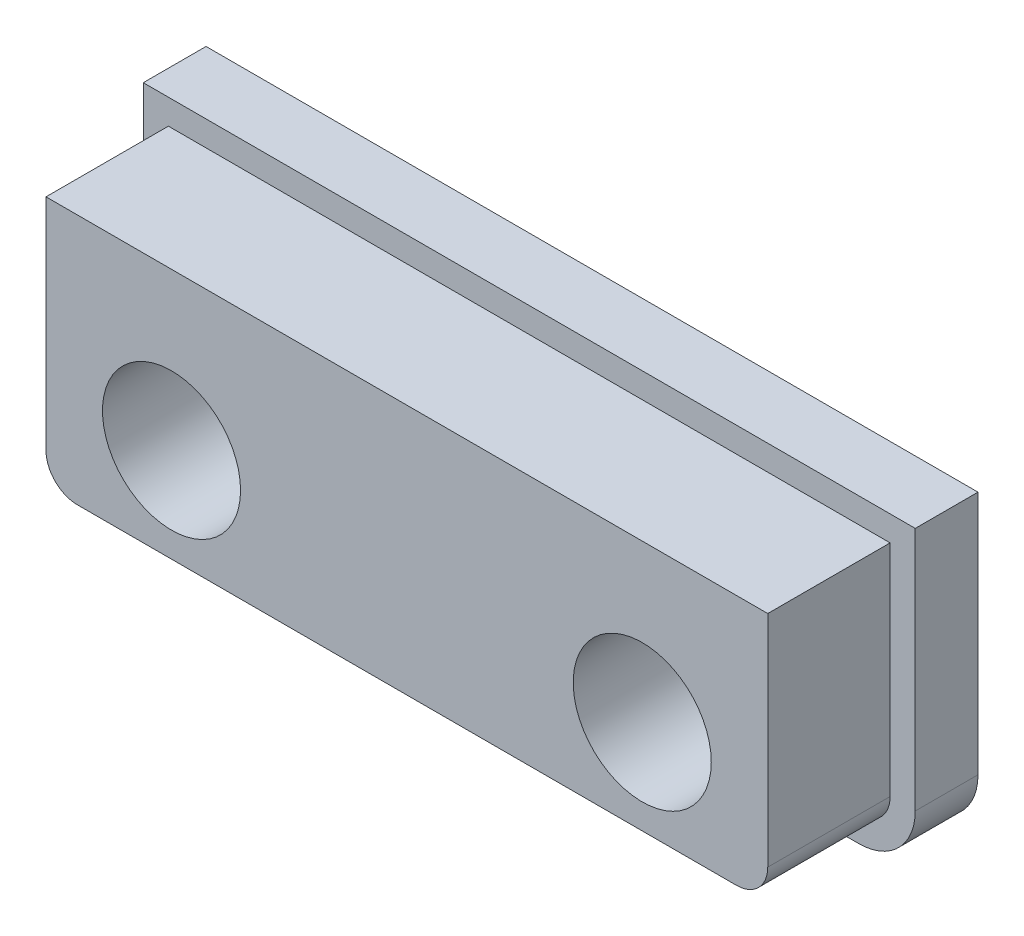
from build123d import *

# Parameters (mm, degrees)
SKETCH1_R           = 2.2
BOSS_EXTRUDE1_DEPTH = 3.9
BOSS_EXTRUDE2_START = -2
SKETCH1_4_R         = 2.2
BOSS_EXTRUDE2_DEPTH = 2


with BuildPart() as part:
    # Sketch1 → Boss-Extrude1 (new body)
    with BuildSketch(Plane.XY):
        with BuildLine():
            ThreePointArc((0, 1), (0.292893219, 0.292893219), (1, 0))
            Line((1, 0), (22, 0))
            ThreePointArc((22, 0), (22.707106781, 0.292893219), (23, 1))
            Line((23, 1), (23, 8))
            Line((23, 8), (0, 8))
            Line((0, 8), (0, 1))
        make_face()
        with Locations((4, 3)):
            Circle(SKETCH1_R, mode=Mode.SUBTRACT)
        with Locations((19, 3)):
            Circle(SKETCH1_R, mode=Mode.SUBTRACT)
    extrude(amount=BOSS_EXTRUDE1_DEPTH)

    # Sketch1<4> → Boss-Extrude2 (add)
    with BuildSketch(Plane.XY.offset(BOSS_EXTRUDE2_START)):
        with BuildLine():
            Line((-0.8, 8.8), (-0.8, 1))
            ThreePointArc((-0.8, 1), (-0.272792206, -0.272792206), (1, -0.8))
            Line((1, -0.8), (22, -0.8))
            ThreePointArc((22, -0.8), (23.272792206, -0.272792206), (23.8, 1))
            Line((23.8, 1), (23.8, 8.8))
            Line((23.8, 8.8), (-0.8, 8.8))
        make_face()
        with Locations((4, 3)):
            Circle(SKETCH1_4_R, mode=Mode.SUBTRACT)
        with Locations((19, 3)):
            Circle(SKETCH1_4_R, mode=Mode.SUBTRACT)
    extrude(amount=BOSS_EXTRUDE2_DEPTH)


solid = part.part
